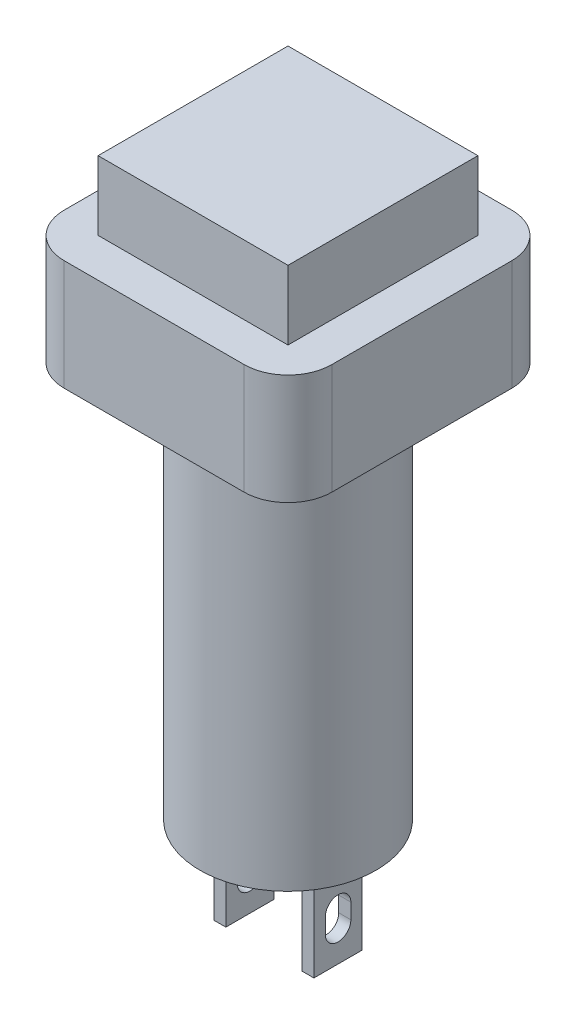
from build123d import *

# Parameters (mm, degrees)
SKETCH1_W           = 15.5
SKETCH1_H           = 15.5
BOSS_EXTRUDE1_DEPTH = 6.4
FILLET1_R           = 2.54
FILLET2_R           = 2.54
FILLET3_R           = 2.54
FILLET4_R           = 2.54
SKETCH2_W           = 11
SKETCH2_H           = 11
BOSS_EXTRUDE2_DEPTH = 4
SKETCH3_R           = 5.1
BOSS_EXTRUDE3_DEPTH = 22.9
SKETCH4_W           = 0.7
SKETCH4_H           = 2.8
BOSS_EXTRUDE4_DEPTH = 5.8
CUT_EXTRUDE1_DEPTH  = 35.312716302


with BuildPart() as part:
    # Sketch1 → Boss-Extrude1 (new body)
    with BuildSketch(Plane(origin=(0, 0, 0), x_dir=(1, 0, 0), z_dir=(0, 1, 0))):
        with Locations((7.75, 7.75)):
            Rectangle(SKETCH1_W, SKETCH1_H)
    extrude(amount=BOSS_EXTRUDE1_DEPTH)

    # Fillet1
    fillet1_edges = [part.edges().sort_by_distance(p)[0] for p in [
        (15.5, 3.2, 0),
    ]]
    fillet(fillet1_edges, radius=FILLET1_R)

    # Fillet2
    fillet2_edges = [part.edges().sort_by_distance(p)[0] for p in [
        (0, 3.2, 0),
    ]]
    fillet(fillet2_edges, radius=FILLET2_R)

    # Fillet3
    fillet3_edges = [part.edges().sort_by_distance(p)[0] for p in [
        (15.5, 3.2, -15.5),
    ]]
    fillet(fillet3_edges, radius=FILLET3_R)

    # Fillet4
    fillet4_edges = [part.edges().sort_by_distance(p)[0] for p in [
        (0, 3.2, -15.5),
    ]]
    fillet(fillet4_edges, radius=FILLET4_R)

    # Sketch2 → Boss-Extrude2 (add)
    with BuildSketch(Plane(origin=(0, 6.4, 0), x_dir=(1, 0, 0), z_dir=(0, 1, 0))):
        with Locations((7.75, 7.75)):
            Rectangle(SKETCH2_W, SKETCH2_H)
    extrude(amount=BOSS_EXTRUDE2_DEPTH)

    # Sketch3 → Boss-Extrude3 (add)
    with BuildSketch(Plane.XZ):
        with Locations(Location((7.75, -7.75, 0), (0, 0, 270))):
            Circle(SKETCH3_R)
    extrude(amount=BOSS_EXTRUDE3_DEPTH)

    # Sketch4 → Boss-Extrude4 (add)
    with BuildSketch(Plane.XZ.offset(22.9)):
        with Locations((5.2, -7.75)):
            Rectangle(SKETCH4_W, SKETCH4_H)
        with Locations((10.3, -7.75)):
            Rectangle(SKETCH4_W, SKETCH4_H)
    extrude(amount=BOSS_EXTRUDE4_DEPTH)

    # Sketch5 → Cut-Extrude1 (cut, through all)
    with BuildSketch(Plane(origin=(10.65, 0, 0), x_dir=(0, 0, -1), z_dir=(1, 0, 0))):
        with BuildLine():
            Line((8.489235797, -25.962974619), (8.489235797, -26.848488265))
            ThreePointArc((8.489235797, -26.848488265), (7.75, -27.587724063), (7.010764203, -26.848488265))
            Line((7.010764203, -26.848488265), (7.010764203, -25.962974619))
            ThreePointArc((7.010764203, -25.962974619), (7.75, -25.223738822), (8.489235797, -25.962974619))
        make_face()
    extrude(amount=-CUT_EXTRUDE1_DEPTH, mode=Mode.SUBTRACT)


solid = part.part
